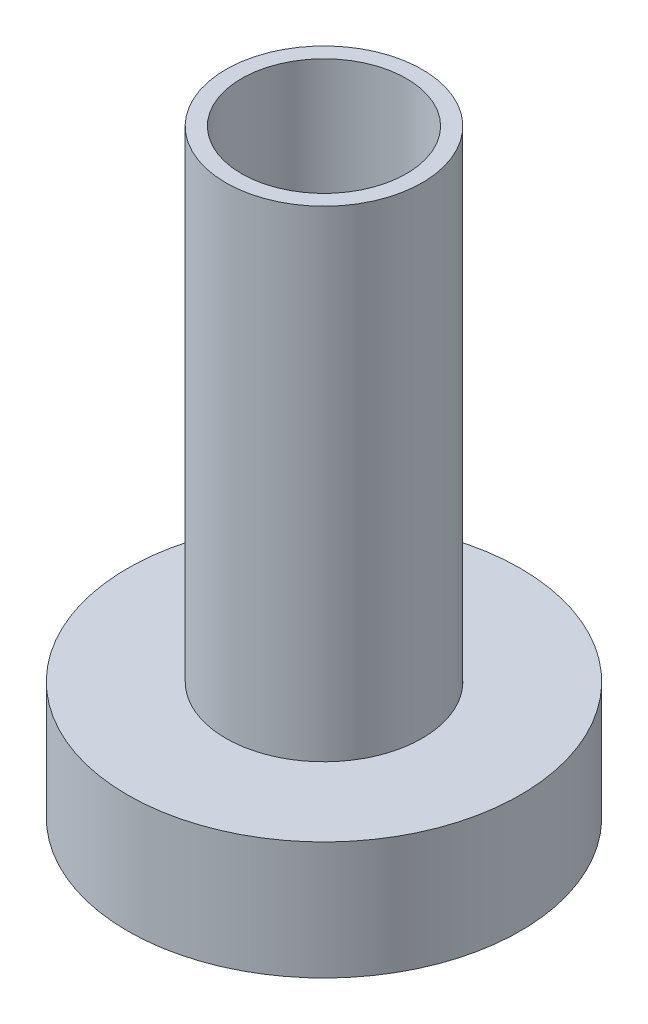
from build123d import *

# Parameters (mm, degrees)
ESBO_O1_R                = 25
ESBO_O1_R_2              = 21
RESSALTO_EXTRUS_O1_DEPTH = 142.5
ESBO_O1_4_R              = 25
ESBO_O1_4_R_2            = 7
RESSALTO_EXTRUS_O2_DEPTH = 10
ESBO_O2_R                = 50
ESBO_O2_R_2              = 25
RESSALTO_EXTRUS_O3_DEPTH = 30


with BuildPart() as part:
    # Esboço1 → Ressalto-extrusão1 (new body)
    with BuildSketch(Plane(origin=(0, 0, 0), x_dir=(1, 0, 0), z_dir=(0, 1, 0))):
        Circle(ESBO_O1_R)
        Circle(ESBO_O1_R_2, mode=Mode.SUBTRACT)
    extrude(amount=RESSALTO_EXTRUS_O1_DEPTH)


with BuildPart() as body_2:
    # Esboço1<4> → Ressalto-extrusão2 (new body)
    with BuildSketch(Plane(origin=(0, 0, 0), x_dir=(1, 0, 0), z_dir=(0, 1, 0))):
        Circle(ESBO_O1_4_R)
        Circle(ESBO_O1_4_R_2, mode=Mode.SUBTRACT)
    extrude(amount=-RESSALTO_EXTRUS_O2_DEPTH)


with BuildPart() as body_3:
    # Esboço2 → Ressalto-extrusão3 (new body)
    with BuildSketch(Plane.XZ.offset(10)):
        Circle(ESBO_O2_R)
        Circle(ESBO_O2_R_2, mode=Mode.SUBTRACT)
    extrude(amount=-RESSALTO_EXTRUS_O3_DEPTH)


with BuildPart() as body_2_1:
    add(body_2.part)

    # Combinar1: union body 3
    add(body_3.part)


solid = Compound([part.part, body_2_1.part])
